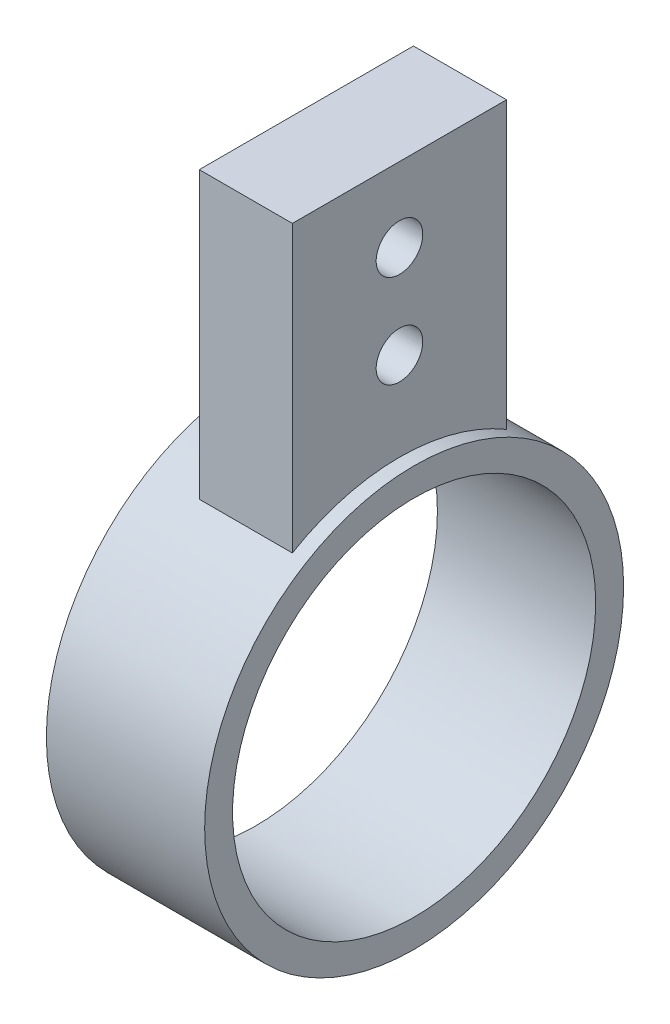
from build123d import *

# Parameters (mm, degrees)
SKETCH2_R                = 22.5
BOSS_EXTRUDE1_DEPTH      = 8.5
BOSS_EXTRUDE2_REACH      = 78.386
BOSS_EXTRUDE2_END_RADIUS = 22.5
SKETCH3_W                = 10
SKETCH3_H                = 23
SKETCH8_R                = 2.5
CUT_EXTRUDE1_DEPTH       = 57.95722287
SKETCH11_R               = 19.5
CUT_EXTRUDE2_DEPTH       = 58.404268134


with BuildPart() as part:
    # Sketch2 → Boss-Extrude1 (new, symmetric)
    with BuildSketch(Plane(origin=(0, 0, 0), x_dir=(0, 0, -1), z_dir=(1, 0, 0))):
        Circle(SKETCH2_R)
    extrude(amount=BOSS_EXTRUDE1_DEPTH, both=True)

    # Boss-Extrude2: up to this cylinder (the profile starts outside it)
    boss_extrude2_end = Plane(origin=(1.923205, 0, 0), z_dir=(-1, 0, 0)) * Cylinder(BOSS_EXTRUDE2_END_RADIUS, 202.772, mode=Mode.PRIVATE)
    # Sketch3 → Boss-Extrude2 (add, up to the surface)
    with BuildSketch(Plane(origin=(0, 50, 0), x_dir=(1, 0, 0), z_dir=(0, 1, 0)), mode=Mode.PRIVATE) as boss_extrude2_sk1:
        with Locations((1.9232045, 0)):
            Rectangle(SKETCH3_W, SKETCH3_H)
    boss_extrude2_tool1 = extrude(boss_extrude2_sk1.sketch, amount=-BOSS_EXTRUDE2_REACH, mode=Mode.PRIVATE) - boss_extrude2_end
    add(boss_extrude2_tool1.solids().sort_by_distance((1.923205, 50, 0))[0])

    # Sketch8 → Cut-Extrude1 (cut, through all)
    with BuildSketch(Plane(origin=(6.9232045, 0, 0), x_dir=(0, 0, -1), z_dir=(1, 0, 0))):
        with Locations((0, 42)):
            Circle(SKETCH8_R)
        with Locations((0, 32)):
            Circle(SKETCH8_R)
    extrude(amount=-CUT_EXTRUDE1_DEPTH, mode=Mode.SUBTRACT)

    # Sketch11 → Cut-Extrude2 (cut, through all)
    with BuildSketch(Plane(origin=(8.5, 0, 0), x_dir=(0, 0, -1), z_dir=(1, 0, 0))):
        Circle(SKETCH11_R)
    extrude(amount=-CUT_EXTRUDE2_DEPTH, mode=Mode.SUBTRACT)


solid = part.part
